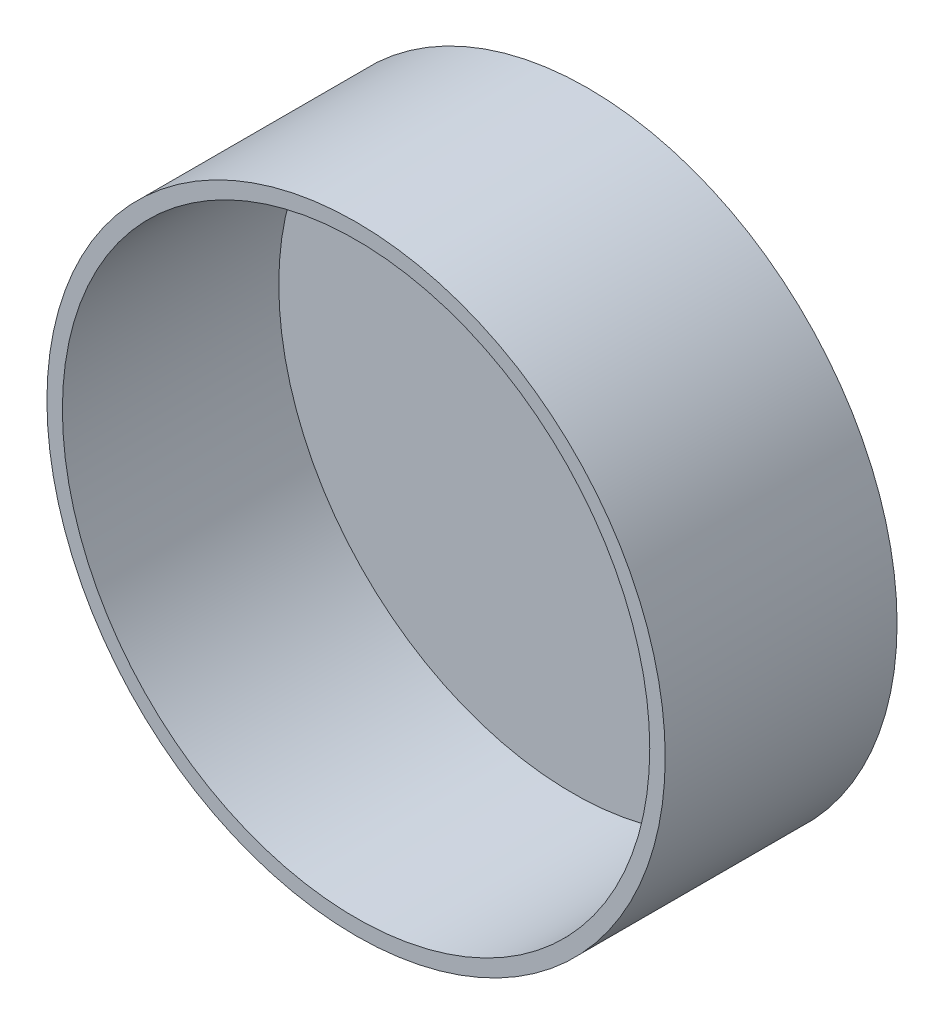
from build123d import *

# Parameters (mm, degrees)
SKETCH_1_R      = 100
SKETCH_1_R_2    = 95
EXTRUDE_1_DEPTH = 70
EXTRUDE_START   = 5
SKETCH_2_R      = 100
EXTRUDE_2_DEPTH = 5


with BuildPart() as part:
    # 草图1 → 凸台-拉伸1 (new body)
    with BuildSketch(Plane.XY):
        Circle(SKETCH_1_R)
        Circle(SKETCH_1_R_2, mode=Mode.SUBTRACT)
    extrude(amount=EXTRUDE_1_DEPTH)

    # 草图2 → 凸台-拉伸2 (add)
    with BuildSketch(Plane(origin=(0, 0, 0), x_dir=(-1, 0, 0), z_dir=(0, 0, -1)).offset(EXTRUDE_START)):
        Circle(SKETCH_2_R)
    extrude(amount=-EXTRUDE_2_DEPTH)


solid = part.part
